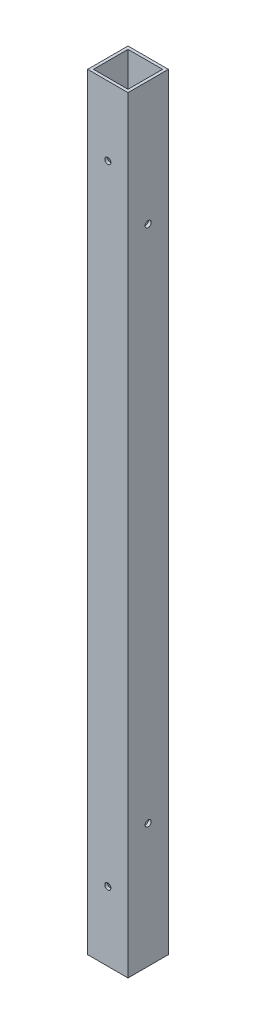
from build123d import *

# Parameters (mm, degrees)
SKETCH1_W                        = 44.45
SKETCH1_H                        = 44.45
SKETCH1_W_2                      = 38.1
SKETCH1_H_2                      = 38.1
BOSS_EXTRUDE1_DEPTH              = 844.55
F_17_64_0_26563_DIAMETER_HOLE1_D = 6.747002
SKETCH6_R                        = 3.3734375
CUT_EXTRUDE1_DEPTH               = 847.010907509


with BuildPart() as part:
    # Sketch1 → Boss-Extrude1 (new body)
    with BuildSketch(Plane(origin=(0, 0, 0), x_dir=(1, 0, 0), z_dir=(0, 1, 0))):
        Rectangle(SKETCH1_W, SKETCH1_H)
        Rectangle(SKETCH1_W_2, SKETCH1_H_2, mode=Mode.SUBTRACT)
    extrude(amount=BOSS_EXTRUDE1_DEPTH)

    # 17/64 (0.26563) Diameter Hole1 (through all)
    with Locations(Plane.XY.offset(22.225)):
        with Locations((0, 768.35), (0, 76.2)):
            Hole(F_17_64_0_26563_DIAMETER_HOLE1_D / 2)

    # Sketch6 → Cut-Extrude1 (cut, through all)
    with BuildSketch(Plane(origin=(22.225, 0, 0), x_dir=(0, 0, -1), z_dir=(1, 0, 0))):
        with Locations((0, 136.525)):
            Circle(SKETCH6_R)
        with Locations((0, 708.025)):
            Circle(SKETCH6_R)
    extrude(amount=-CUT_EXTRUDE1_DEPTH, mode=Mode.SUBTRACT)


solid = part.part
